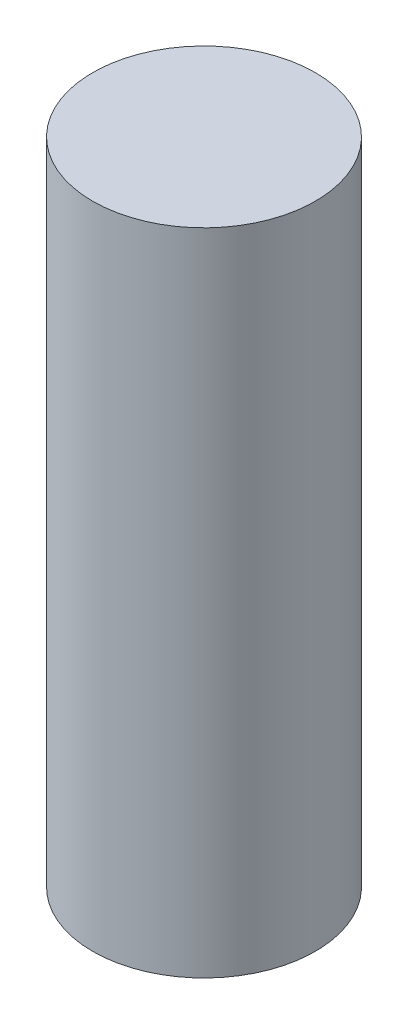
from build123d import *

# Parameters (mm, degrees)
SKETCH1_R           = 152.4
BOSS_EXTRUDE1_DEPTH = 889


with BuildPart() as part:
    # Sketch1 → Boss-Extrude1 (new body)
    with BuildSketch(Plane(origin=(0, 0, 0), x_dir=(1, 0, 0), z_dir=(0, 1, 0))):
        with Locations(Location((0, 0, 0), (0, 0, 270))):
            Circle(SKETCH1_R)
    extrude(amount=BOSS_EXTRUDE1_DEPTH)


solid = part.part
